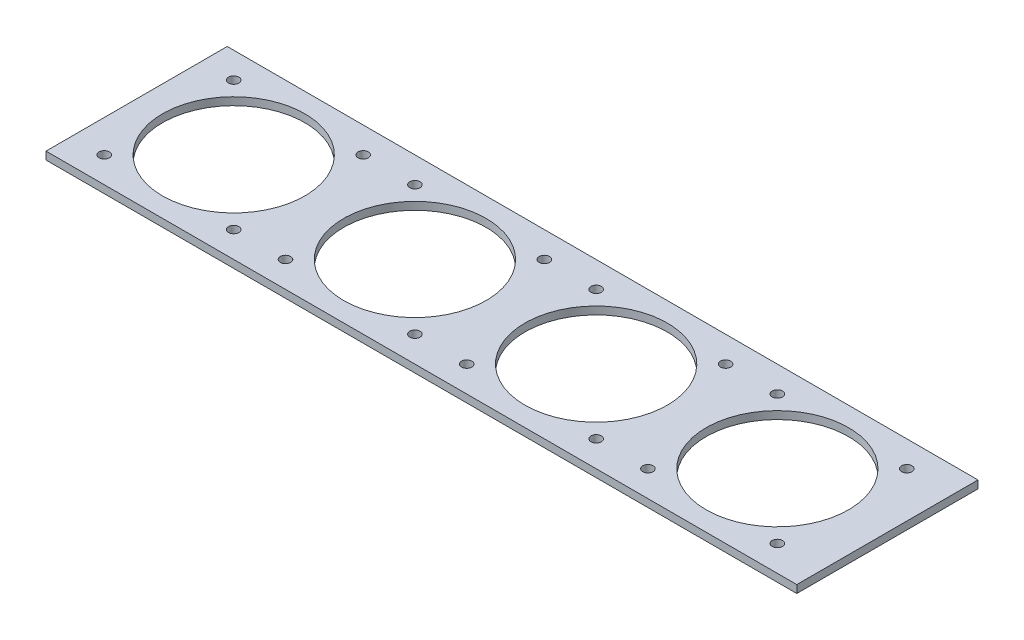
from build123d import *

# Parameters (mm, degrees)
IZIM1_W                     = 290
IZIM1_H                     = 70
IZIM1_R                     = 27.5
IZIM1_R_2                   = 2
Y_KSEKLIK_EKSTR_ZYON1_DEPTH = 3


with BuildPart() as part:
    # Çizim1 → Yükseklik-Ekstrüzyon1 (new body)
    with BuildSketch(Plane(origin=(0, 0, 0), x_dir=(1, 0, 0), z_dir=(0, 1, 0))):
        with Locations((145, 35)):
            Rectangle(IZIM1_W, IZIM1_H)
        with Locations(Location((37.5, 35, 0), (0, 0, 270))):
            Circle(IZIM1_R, mode=Mode.SUBTRACT)
        with Locations(Location((12.5, 60, 0), (0, 0, 270))):
            Circle(IZIM1_R_2, mode=Mode.SUBTRACT)
        with Locations(Location((62.5, 60, 0), (0, 0, 270))):
            Circle(IZIM1_R_2, mode=Mode.SUBTRACT)
        with Locations(Location((62.5, 10, 0), (0, 0, 270))):
            Circle(IZIM1_R_2, mode=Mode.SUBTRACT)
        with Locations(Location((12.5, 10, 0), (0, 0, 270))):
            Circle(IZIM1_R_2, mode=Mode.SUBTRACT)
        with Locations(Location((107.5, 35, 0), (0, 0, 270))):
            Circle(IZIM1_R, mode=Mode.SUBTRACT)
        with Locations(Location((132.5, 60, 0), (0, 0, 270))):
            Circle(IZIM1_R_2, mode=Mode.SUBTRACT)
        with Locations(Location((132.5, 10, 0), (0, 0, 270))):
            Circle(IZIM1_R_2, mode=Mode.SUBTRACT)
        with Locations(Location((82.5, 10, 0), (0, 0, 270))):
            Circle(IZIM1_R_2, mode=Mode.SUBTRACT)
        with Locations(Location((82.5, 60, 0), (0, 0, 270))):
            Circle(IZIM1_R_2, mode=Mode.SUBTRACT)
        with Locations(Location((177.5, 35, 0), (0, 0, 270))):
            Circle(IZIM1_R, mode=Mode.SUBTRACT)
        with Locations(Location((202.5, 60, 0), (0, 0, 270))):
            Circle(IZIM1_R_2, mode=Mode.SUBTRACT)
        with Locations(Location((202.5, 10, 0), (0, 0, 270))):
            Circle(IZIM1_R_2, mode=Mode.SUBTRACT)
        with Locations(Location((152.5, 10, 0), (0, 0, 270))):
            Circle(IZIM1_R_2, mode=Mode.SUBTRACT)
        with Locations(Location((152.5, 60, 0), (0, 0, 270))):
            Circle(IZIM1_R_2, mode=Mode.SUBTRACT)
        with Locations(Location((247.5, 35, 0), (0, 0, 270))):
            Circle(IZIM1_R, mode=Mode.SUBTRACT)
        with Locations(Location((272.5, 60, 0), (0, 0, 270))):
            Circle(IZIM1_R_2, mode=Mode.SUBTRACT)
        with Locations(Location((272.5, 10, 0), (0, 0, 270))):
            Circle(IZIM1_R_2, mode=Mode.SUBTRACT)
        with Locations(Location((222.5, 10, 0), (0, 0, 270))):
            Circle(IZIM1_R_2, mode=Mode.SUBTRACT)
        with Locations(Location((222.5, 60, 0), (0, 0, 270))):
            Circle(IZIM1_R_2, mode=Mode.SUBTRACT)
    extrude(amount=Y_KSEKLIK_EKSTR_ZYON1_DEPTH)


solid = part.part
